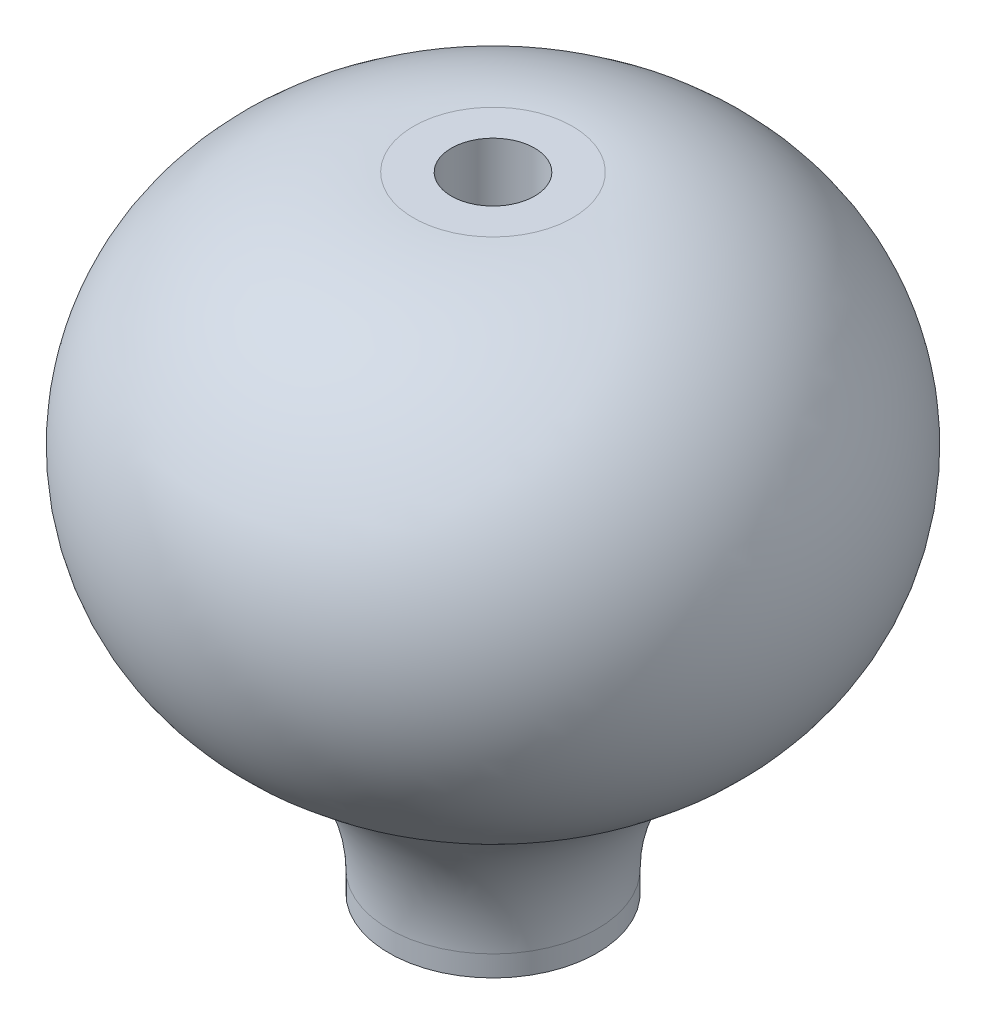
from build123d import *

# Parameters (mm, degrees)
SKETCH2_R          = 2.54
CUT_EXTRUDE1_DEPTH = 47.852337361


with BuildPart() as part:
    # Sketch1 → Revolve1 (revolve)
    with BuildSketch(Plane.XY, mode=Mode.PRIVATE) as revolve1_sk:
        with BuildLine():
            Line((0, 0), (6.35, 0))
            Line((6.35, 0), (6.35, 1.27))
            ThreePointArc((6.35, 1.27), (7.881329635, 6.985), (12.065, 11.168670365))
            ThreePointArc((12.065, 11.168670365), (18.789454012, 27.402938441), (4.848771973, 38.1))
            Line((4.848771973, 38.1), (0, 38.1))
            Line((0, 38.1), (0, 0))
        make_face()
    revolve(revolve1_sk.sketch.rotate(Axis((0, 0, 0), (0, 1, 0)), 90), axis=Axis((0, 0, 0), (0, 1, 0)))

    # Sketch2 → Cut-Extrude1 (cut, through all)
    with BuildSketch(Plane(origin=(0, 38.1, 0), x_dir=(1, 0, 0), z_dir=(0, 1, 0))):
        with Locations(Location((0, 0, 0), (0, 0, 270))):
            Circle(SKETCH2_R)
    extrude(amount=-CUT_EXTRUDE1_DEPTH, mode=Mode.SUBTRACT)


solid = part.part
